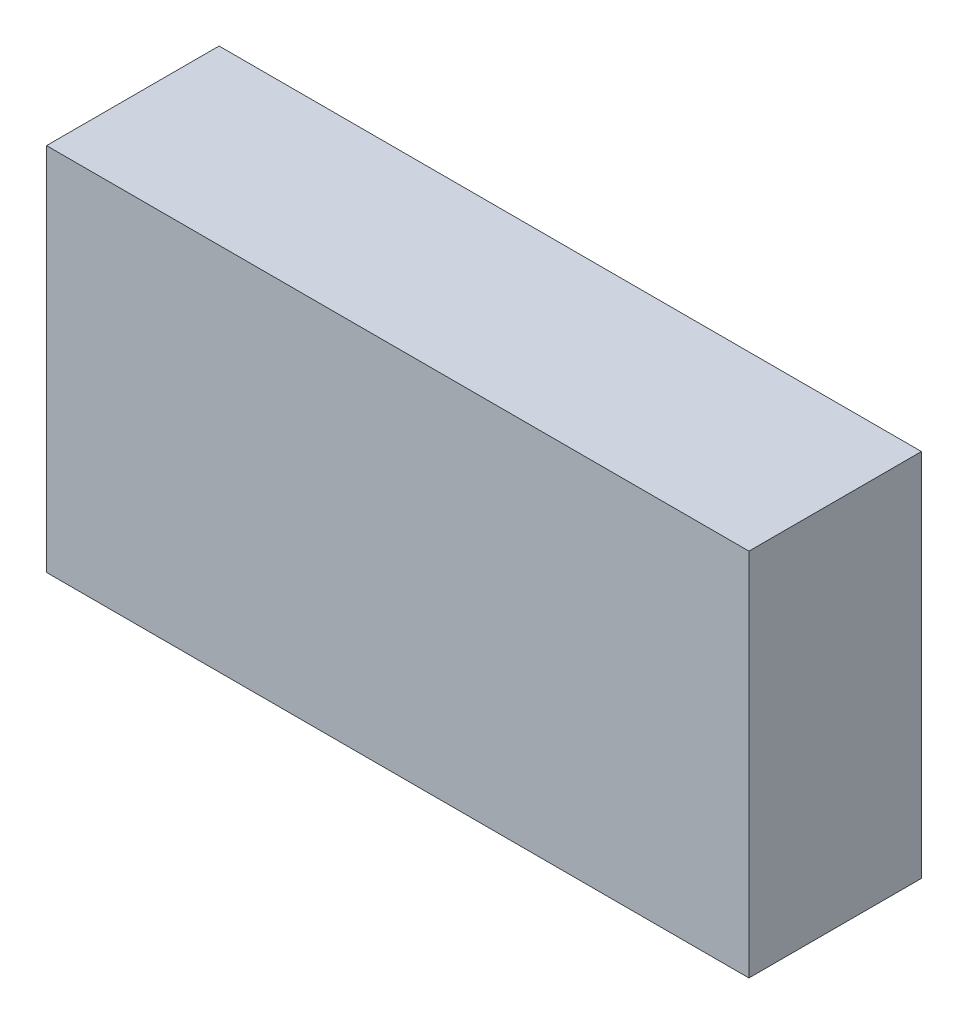
from build123d import *

# Parameters (mm, degrees)
SKETCH1_W           = 57
SKETCH1_H           = 30
BOSS_EXTRUDE1_DEPTH = 14


with BuildPart() as part:
    # Sketch1 → Boss-Extrude1 (new body)
    with BuildSketch(Plane.XY):
        Rectangle(SKETCH1_W, SKETCH1_H)
    extrude(amount=BOSS_EXTRUDE1_DEPTH)


solid = part.part
